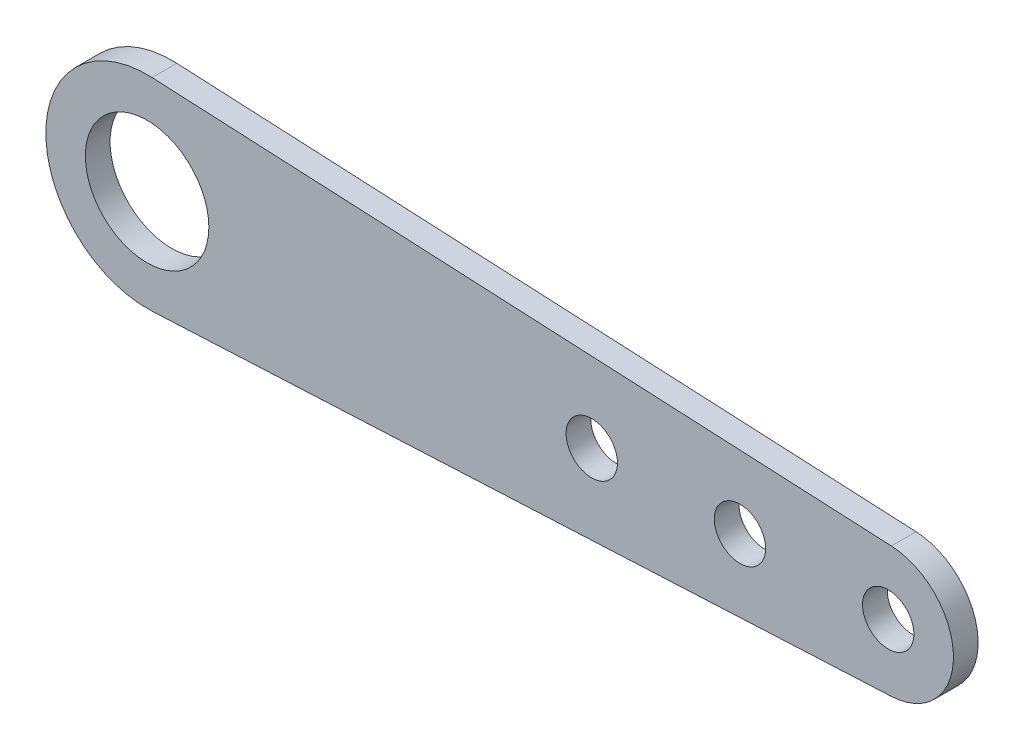
from build123d import *

# Parameters (mm, degrees)
SKETCH1_R          = 7.9375
SKETCH1_R_2        = 3.302
EXTRUDE_BODY_DEPTH = 3.175


with BuildPart() as part:
    # Sketch1 → Extrude - Body (new body)
    with BuildSketch(Plane.XY):
        with BuildLine():
            Line((0.633518333, 13.002075249), (95.657924, 8.372067965))
            ThreePointArc((95.657924, 8.372067965), (103.632, 0), (95.657924, -8.372067965))
            Line((95.657924, -8.372067965), (0.633518333, -13.002075249))
            ThreePointArc((0.633518333, -13.002075249), (-13.0175, 0), (0.633518333, 13.002075249))
        make_face()
        Circle(SKETCH1_R, mode=Mode.SUBTRACT)
        with Locations((57.15, 0)):
            Circle(SKETCH1_R_2, mode=Mode.SUBTRACT)
        with Locations((76.2, 0)):
            Circle(SKETCH1_R_2, mode=Mode.SUBTRACT)
        with Locations((95.25, 0)):
            Circle(SKETCH1_R_2, mode=Mode.SUBTRACT)
    extrude(amount=EXTRUDE_BODY_DEPTH)


solid = part.part
